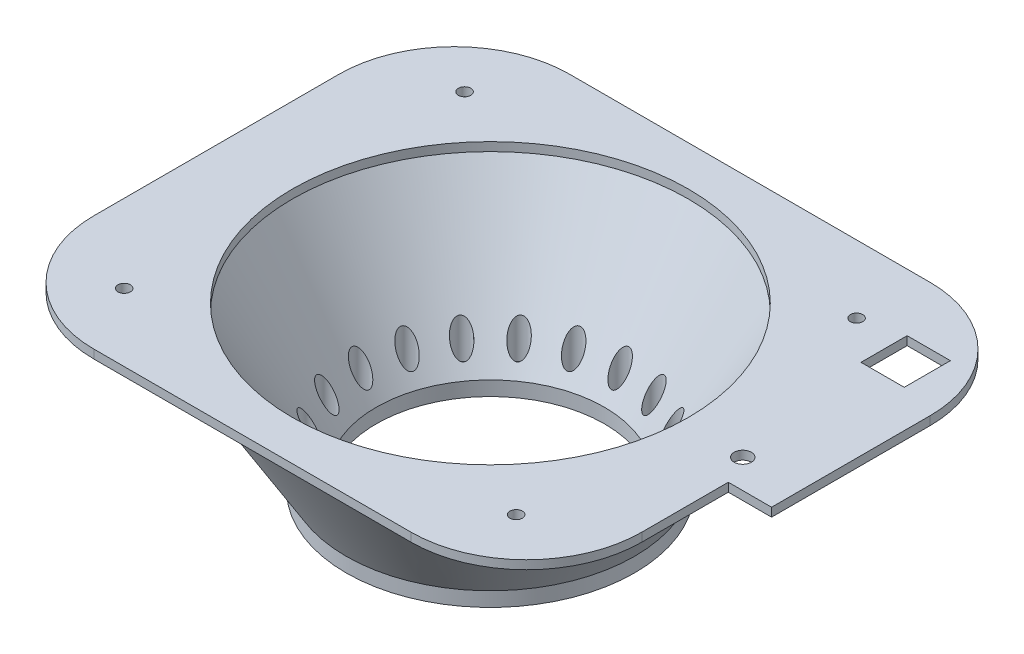
from build123d import *

# Parameters (mm, degrees)
SKETCH4_R           = 50
SKETCH4_R_2         = 39.565
SKETCH4_R_3         = 1.75
BOSS_EXTRUDE3_DEPTH = 5
SKETCH7_W           = 190
SKETCH7_H           = 165
SKETCH7_R           = 68.628897091
SKETCH7_R_2         = 2.15
BOSS_EXTRUDE4_DEPTH = 3
FILLET1_R           = 40
CUT_EXTRUDE1_START  = -5
SKETCH8_R           = 3
CUT_EXTRUDE1_DEPTH  = 133.721639549
BOSS_EXTRUDE7_DEPTH = 3
SKETCH12_R          = 3
CUT_EXTRUDE3_DEPTH  = 149.466326148
FILLET2_R           = 40
SKETCH13_W          = 15
SKETCH13_H          = 16
CUT_EXTRUDE4_DEPTH  = 149.466326148


with BuildPart() as part:
    # Sketch4 → Boss-Extrude3 (new body)
    with BuildSketch(Plane(origin=(0, 0, 0), x_dir=(1, 0, 0), z_dir=(0, 1, 0))):
        with Locations(Location((0, 0, 0), (0, 0, 270))):
            Circle(SKETCH4_R)
        with Locations(Location((0, 0, 0), (0, 0, 270))):
            Circle(SKETCH4_R_2, mode=Mode.SUBTRACT)
        with Locations(Location((0, -45, 0), (0, 0, 270))):
            Circle(SKETCH4_R_3, mode=Mode.SUBTRACT)
        with Locations(Location((-13.905764747, -42.797543233, 0), (0, 0, 270))):
            Circle(SKETCH4_R_3, mode=Mode.SUBTRACT)
        with Locations(Location((-26.450336353, -36.405764747, 0), (0, 0, 270))):
            Circle(SKETCH4_R_3, mode=Mode.SUBTRACT)
        with Locations(Location((-36.405764747, -26.450336353, 0), (0, 0, 270))):
            Circle(SKETCH4_R_3, mode=Mode.SUBTRACT)
        with Locations(Location((-42.797543233, -13.905764747, 0), (0, 0, 270))):
            Circle(SKETCH4_R_3, mode=Mode.SUBTRACT)
        with Locations(Location((-45, 0, 0), (0, 0, 270))):
            Circle(SKETCH4_R_3, mode=Mode.SUBTRACT)
        with Locations(Location((-42.797543233, 13.905764747, 0), (0, 0, 270))):
            Circle(SKETCH4_R_3, mode=Mode.SUBTRACT)
        with Locations(Location((-36.405764747, 26.450336353, 0), (0, 0, 270))):
            Circle(SKETCH4_R_3, mode=Mode.SUBTRACT)
        with Locations(Location((-26.450336353, 36.405764747, 0), (0, 0, 270))):
            Circle(SKETCH4_R_3, mode=Mode.SUBTRACT)
        with Locations(Location((-13.905764747, 42.797543233, 0), (0, 0, 270))):
            Circle(SKETCH4_R_3, mode=Mode.SUBTRACT)
        with Locations(Location((0, 45, 0), (0, 0, 270))):
            Circle(SKETCH4_R_3, mode=Mode.SUBTRACT)
        with Locations(Location((13.905764747, 42.797543233, 0), (0, 0, 270))):
            Circle(SKETCH4_R_3, mode=Mode.SUBTRACT)
        with Locations(Location((26.450336353, 36.405764747, 0), (0, 0, 270))):
            Circle(SKETCH4_R_3, mode=Mode.SUBTRACT)
        with Locations(Location((36.405764747, 26.450336353, 0), (0, 0, 270))):
            Circle(SKETCH4_R_3, mode=Mode.SUBTRACT)
        with Locations(Location((42.797543233, 13.905764747, 0), (0, 0, 270))):
            Circle(SKETCH4_R_3, mode=Mode.SUBTRACT)
        with Locations(Location((45, 0, 0), (0, 0, 270))):
            Circle(SKETCH4_R_3, mode=Mode.SUBTRACT)
        with Locations(Location((42.797543233, -13.905764747, 0), (0, 0, 270))):
            Circle(SKETCH4_R_3, mode=Mode.SUBTRACT)
        with Locations(Location((36.405764747, -26.450336353, 0), (0, 0, 270))):
            Circle(SKETCH4_R_3, mode=Mode.SUBTRACT)
        with Locations(Location((26.450336353, -36.405764747, 0), (0, 0, 270))):
            Circle(SKETCH4_R_3, mode=Mode.SUBTRACT)
        with Locations(Location((13.905764747, -42.797543233, 0), (0, 0, 270))):
            Circle(SKETCH4_R_3, mode=Mode.SUBTRACT)
    extrude(amount=BOSS_EXTRUDE3_DEPTH)

    # Sketch6 → Revolve1 (revolve)
    with BuildSketch(Plane(origin=(0, 0, 0), x_dir=(0, 0, -1), z_dir=(1, 0, 0)), mode=Mode.PRIVATE) as revolve1_sk:
        Polygon((-50, 5), (-79.06281292, 53), (-68.62781292, 53), (-39.565, 5), align=None)
    revolve(revolve1_sk.sketch.rotate(Axis((0, 0, 0), (0, 1, 0)), 180), axis=Axis((0, 0, 0), (0, 1, 0)))

    # Sketch7 → Boss-Extrude4 (add)
    with BuildSketch(Plane(origin=(0, 53, 0), x_dir=(1, 0, 0), z_dir=(0, 1, 0))):
        Rectangle(SKETCH7_W, SKETCH7_H)
        with Locations(Location((0, 0, 0), (0, 0, 270))):
            Circle(SKETCH7_R, mode=Mode.SUBTRACT)
        with Locations(Location((-67.952980655, 59.01179899, 0), (0, 0, 270))):
            Circle(SKETCH7_R_2, mode=Mode.SUBTRACT)
        with Locations(Location((67.952980655, 59.01179899, 0), (0, 0, 270))):
            Circle(SKETCH7_R_2, mode=Mode.SUBTRACT)
        with Locations(Location((67.952980655, -59.01179899, 0), (0, 0, 270))):
            Circle(SKETCH7_R_2, mode=Mode.SUBTRACT)
        with Locations(Location((-67.952980655, -59.01179899, 0), (0, 0, 270))):
            Circle(SKETCH7_R_2, mode=Mode.SUBTRACT)
    extrude(amount=BOSS_EXTRUDE4_DEPTH)

    # Fillet1
    fillet1_edges = [part.edges().sort_by_distance(p)[0] for p in [
        (-95, 54.5, -82.5),
        (-95, 54.5, 82.5),
        (95, 54.5, 82.5),
        (95, 54.5, -82.5),
    ]]
    fillet(fillet1_edges, radius=FILLET1_R)

    # Sketch8 → Cut-Extrude1 (cut, through all)
    with BuildSketch(Plane.XZ.offset(CUT_EXTRUDE1_START)):
        with Locations(Location((0, -45, 0), (0, 0, 270))):
            Circle(SKETCH8_R)
        with Locations(Location((-13.905764747, -42.797543233, 0), (0, 0, 270))):
            Circle(SKETCH8_R)
        with Locations(Location((-26.450336353, -36.405764747, 0), (0, 0, 270))):
            Circle(SKETCH8_R)
        with Locations(Location((-36.405764747, -26.450336353, 0), (0, 0, 270))):
            Circle(SKETCH8_R)
        with Locations(Location((-42.797543233, -13.905764747, 0), (0, 0, 270))):
            Circle(SKETCH8_R)
        with Locations(Location((-45, 0, 0), (0, 0, 270))):
            Circle(SKETCH8_R)
        with Locations(Location((-42.797543233, 13.905764747, 0), (0, 0, 270))):
            Circle(SKETCH8_R)
        with Locations(Location((-36.405764747, 26.450336353, 0), (0, 0, 270))):
            Circle(SKETCH8_R)
        with Locations(Location((-26.450336353, 36.405764747, 0), (0, 0, 270))):
            Circle(SKETCH8_R)
        with Locations(Location((-13.905764747, 42.797543233, 0), (0, 0, 270))):
            Circle(SKETCH8_R)
        with Locations(Location((0, 45, 0), (0, 0, 270))):
            Circle(SKETCH8_R)
        with Locations(Location((13.905764747, 42.797543233, 0), (0, 0, 270))):
            Circle(SKETCH8_R)
        with Locations(Location((26.450336353, 36.405764747, 0), (0, 0, 270))):
            Circle(SKETCH8_R)
        with Locations(Location((36.405764747, 26.450336353, 0), (0, 0, 270))):
            Circle(SKETCH8_R)
        with Locations(Location((42.797543233, 13.905764747, 0), (0, 0, 270))):
            Circle(SKETCH8_R)
        with Locations(Location((45, 0, 0), (0, 0, 270))):
            Circle(SKETCH8_R)
        with Locations(Location((42.797543233, -13.905764747, 0), (0, 0, 270))):
            Circle(SKETCH8_R)
        with Locations(Location((36.405764747, -26.450336353, 0), (0, 0, 270))):
            Circle(SKETCH8_R)
        with Locations(Location((26.450336353, -36.405764747, 0), (0, 0, 270))):
            Circle(SKETCH8_R)
        with Locations(Location((13.905764747, -42.797543233, 0), (0, 0, 270))):
            Circle(SKETCH8_R)
    extrude(amount=-CUT_EXTRUDE1_DEPTH, mode=Mode.SUBTRACT)

    # Sketch11 → Boss-Extrude7 (add)
    with BuildSketch(Plane(origin=(0, 56, 0), x_dir=(1, 0, 0), z_dir=(0, 1, 0))):
        Polygon((55, 82.5), (110, 82.5), (110, -12.5), (78.906607523, -12.5), (78.906607523, 68.601889393), (55, 68.601889393), align=None)
    extrude(amount=-BOSS_EXTRUDE7_DEPTH)

    # Sketch12 → Cut-Extrude3 (cut, through all)
    with BuildSketch(Plane(origin=(0, 56, 0), x_dir=(1, 0, 0), z_dir=(0, 1, 0))):
        with Locations(Location((90, -2.5, 0), (0, 0, 270))):
            Circle(SKETCH12_R)
    extrude(amount=-CUT_EXTRUDE3_DEPTH, mode=Mode.SUBTRACT)

    # Fillet2
    fillet2_edges = [part.edges().sort_by_distance(p)[0] for p in [
        (110, 54.5, -82.5),
    ]]
    fillet(fillet2_edges, radius=FILLET2_R)

    # Sketch13 → Cut-Extrude4 (cut, through all)
    with BuildSketch(Plane(origin=(0, 56, 0), x_dir=(1, 0, 0), z_dir=(0, 1, 0))):
        with Locations((89.5, 54.5)):
            Rectangle(SKETCH13_W, SKETCH13_H)
    extrude(amount=-CUT_EXTRUDE4_DEPTH, mode=Mode.SUBTRACT)


solid = part.part
